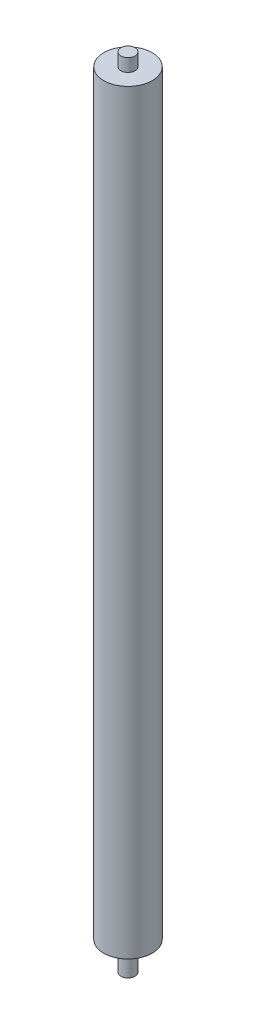
from build123d import *

# Parameters (mm, degrees)
SKETCH1_R           = 10
BOSS_EXTRUDE1_DEPTH = 40
SKETCH2_R           = 34
BOSS_EXTRUDE2_DEPTH = 1060
SKETCH3_R           = 10
BOSS_EXTRUDE3_DEPTH = 18


with BuildPart() as part:
    # Sketch1 → Boss-Extrude1 (new body)
    with BuildSketch(Plane(origin=(0, 0, 0), x_dir=(1, 0, 0), z_dir=(0, 1, 0))):
        with Locations(Location((0, 0, 0), (0, 0, 270))):
            Circle(SKETCH1_R)
    extrude(amount=BOSS_EXTRUDE1_DEPTH)

    # Sketch2 → Boss-Extrude2 (add)
    with BuildSketch(Plane(origin=(0, 40, 0), x_dir=(1, 0, 0), z_dir=(0, 1, 0))):
        with Locations(Location((0, 0, 0), (0, 0, 270))):
            Circle(SKETCH2_R)
    extrude(amount=BOSS_EXTRUDE2_DEPTH)

    # Sketch3 → Boss-Extrude3 (add)
    with BuildSketch(Plane(origin=(0, 1100, 0), x_dir=(1, 0, 0), z_dir=(0, 1, 0))):
        with Locations(Location((0, 0, 0), (0, 0, 270))):
            Circle(SKETCH3_R)
    extrude(amount=BOSS_EXTRUDE3_DEPTH)


solid = part.part
